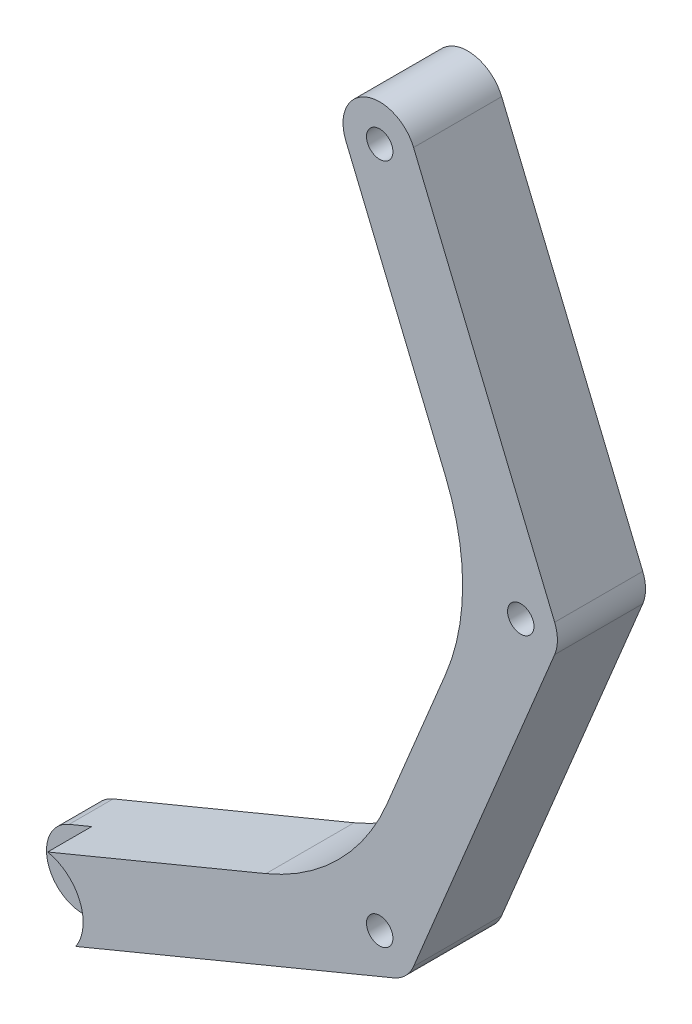
from build123d import *

# Parameters (mm, degrees)
BOSS_EXTRUDE1_DEPTH     = 5
SKETCH2_R               = 2.5
CUT_EXTRUDE1_DEPTH      = 2.5
CUT_EXTRUDE2_DEPTH      = 42.668225696
CUT_EXTRUDE2_DEPTH_BACK = 42.668225696
SKETCH3_R               = 0.75
CUT_EXTRUDE3_DEPTH      = 42.892613104
CUT_EXTRUDE3_DEPTH_BACK = 42.892613104
SKETCH4_R               = 0.75


with BuildPart() as part:
    # Sketch1 → Boss-Extrude1 (new body)
    with BuildSketch(Plane.XY):
        with BuildLine():
            Line((21.247555139, 20.121649117), (29.252444861, 0.796135783))
            ThreePointArc((29.252444861, 0.796135783), (29.410806115, 0), (29.252444861, -0.796135783))
            Line((29.252444861, -0.796135783), (21.247555139, -20.121649117))
            ThreePointArc((21.247555139, -20.121649117), (20.796580444, -20.796580444), (20.121649117, -21.247555139))
            Line((20.121649117, -21.247555139), (0.796135783, -29.252444861))
            ThreePointArc((0.796135783, -29.252444861), (-1.922041804, -28.12653884), (-0.796135783, -25.408361253))
            Line((-0.796135783, -25.408361253), (12.873162178, -19.74635265))
            ThreePointArc((12.873162178, -19.74635265), (16.993338708, -16.993338708), (19.74635265, -12.873162178))
            Line((19.74635265, -12.873162178), (23.065480134, -4.860079591))
            ThreePointArc((23.065480134, -4.860079591), (24.032210071, 0), (23.065480134, 4.860079591))
            Line((23.065480134, 4.860079591), (17.40347153, 18.529377552))
            ThreePointArc((17.40347153, 18.529377552), (18.529377552, 21.247555139), (21.247555139, 20.121649117))
        make_face()
    extrude(amount=BOSS_EXTRUDE1_DEPTH)

    # Sketch2 → Cut-Extrude1 (cut)
    with BuildSketch(Plane.XY.offset(5)):
        with Locations((0, -27.330403057)):
            Circle(SKETCH2_R)
    extrude(amount=-CUT_EXTRUDE1_DEPTH, mode=Mode.SUBTRACT)

    # Sketch3 → Cut-Extrude2 (cut, two sides: drawn at the far end of the back side and taken through both)
    with BuildSketch(Plane.XY.offset(2.5).offset(-CUT_EXTRUDE2_DEPTH_BACK)):
        with Locations((0, -27.330403057)):
            Circle(SKETCH3_R)
    extrude(amount=CUT_EXTRUDE2_DEPTH + CUT_EXTRUDE2_DEPTH_BACK, mode=Mode.SUBTRACT)

    # Sketch4 → Cut-Extrude3 (cut, two sides: drawn at the far end of the back side and taken through both)
    with BuildSketch(Plane(origin=(0, 0, 0), x_dir=(-1, 0, 0), z_dir=(0, 0, -1)).offset(-CUT_EXTRUDE3_DEPTH_BACK)):
        with Locations((-19.325513334, 19.325513334)):
            Circle(SKETCH4_R)
        with Locations((-27.330403057, 0)):
            Circle(SKETCH4_R)
        with Locations((-19.325513334, -19.325513334)):
            Circle(SKETCH4_R)
    extrude(amount=CUT_EXTRUDE3_DEPTH + CUT_EXTRUDE3_DEPTH_BACK, mode=Mode.SUBTRACT)


solid = part.part
